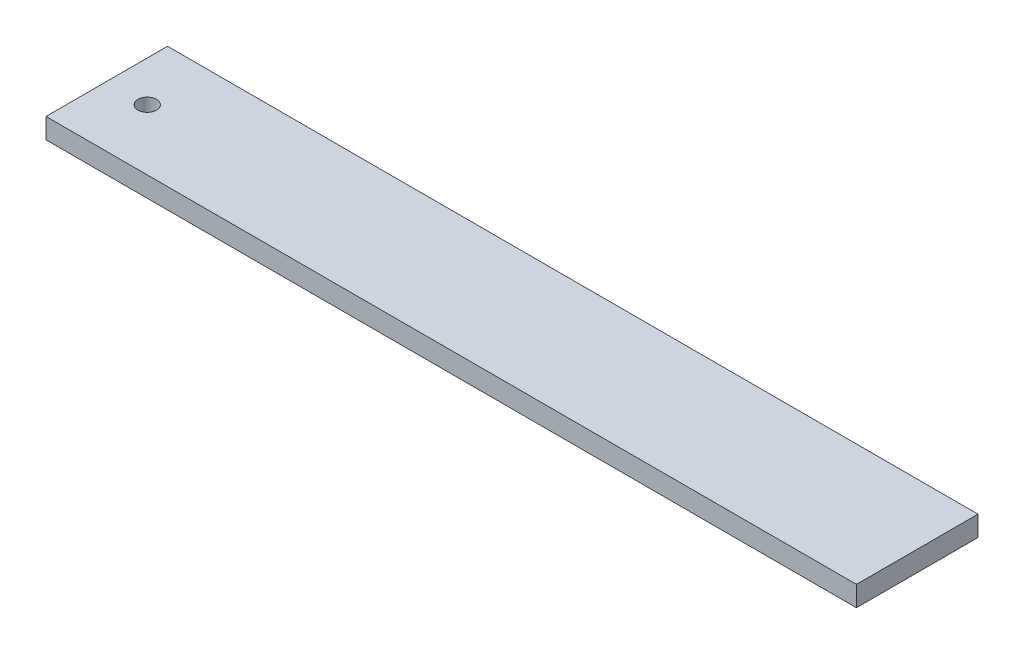
from build123d import *

# Parameters (mm, degrees)
SKETCH1_W           = 127
SKETCH1_H           = 19.05
SKETCH1_R           = 1.4605
BOSS_EXTRUDE1_DEPTH = 3.175


with BuildPart() as part:
    # Sketch1 → Boss-Extrude1 (new body)
    with BuildSketch(Plane(origin=(0, 0, 0), x_dir=(1, 0, 0), z_dir=(0, 1, 0))):
        with Locations((63.5, 9.525)):
            Rectangle(SKETCH1_W, SKETCH1_H)
        with Locations(Location((6.35, 9.525, 0), (0, 0, 270))):
            Circle(SKETCH1_R, mode=Mode.SUBTRACT)
    extrude(amount=BOSS_EXTRUDE1_DEPTH)


solid = part.part
